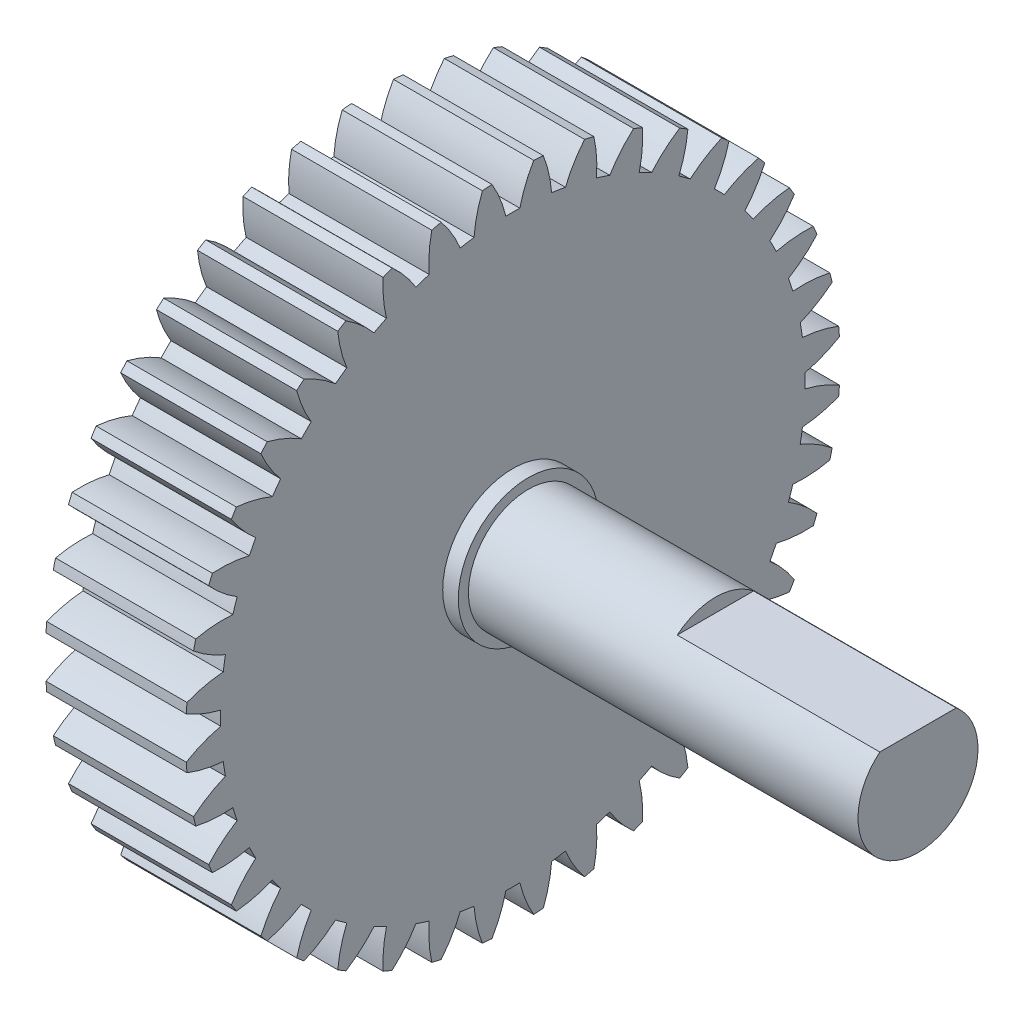
from build123d import *

# Parameters (mm, degrees)
BASPROSKE_W              = 9
BASPROSKE_H              = 21
TOOTHCUT_DEPTH           = 32.032241298
TEETHCUTS_COUNT          = 40
TEETHCUTS_ANGLE          = 351
BORSKE_R                 = 2
BORE_DEPTH               = 50.0000508
BOSS_EXTRUDE1_DEPTH      = 26
BOSS_EXTRUDE1_DEPTH_BACK = 9
BOSS_EXTRUDE2_DEPTH      = 13
BOSS_EXTRUDE2_DEPTH_BACK = 9
SKETCH1_4_R              = 4.5
BOSS_EXTRUDE3_DEPTH      = 1


with BuildPart() as part:
    # BasProSke → Base-Revolve (revolve)
    with BuildSketch(Plane(origin=(0, 0, 0), x_dir=(1, 0, 0), z_dir=(0, 1, 0))):
        with Locations((4.5, 10.5)):
            Rectangle(BASPROSKE_W, BASPROSKE_H)
    revolve(axis=Axis((-10, 0, 0), (1, 0, 0)))

    # TooCutSke → ToothCut (cut, through all)
    with BuildSketch(Plane(origin=(0, 0, 0), x_dir=(0, 0, -1), z_dir=(1, 0, 0))):
        with BuildLine():
            ThreePointArc((0.448673268, 18.74363074), (0, 18.749), (-0.448673268, 18.74363074))
            ThreePointArc((-0.448673268, 18.74363074), (-0.816786816, 19.89705013), (-1.354745081, 20.981708961))
            ThreePointArc((-1.354745081, 20.981708961), (0, 21.0254), (1.354745081, 20.981708961))
            ThreePointArc((1.354745081, 20.981708961), (0.816786816, 19.89705013), (0.448673268, 18.74363074))
        make_face()
    toothcut = extrude(amount=TOOTHCUT_DEPTH, mode=Mode.SUBTRACT)

    # TeethCuts: ToothCut ×40 about axis
    teethcuts_axis = Axis((-10, 0, 0), (1, 0, 0))
    for i in range(1, TEETHCUTS_COUNT):
        add(toothcut.rotate(teethcuts_axis, i * TEETHCUTS_ANGLE / (TEETHCUTS_COUNT - 1)), mode=Mode.SUBTRACT)

    # BorSke → Bore (cut, symmetric)
    with BuildSketch(Plane(origin=(0, 0, 0), x_dir=(0, 0, -1), z_dir=(1, 0, 0))):
        Circle(BORSKE_R)
    extrude(amount=BORE_DEPTH, both=True, mode=Mode.SUBTRACT)

    # Sketch1 → Boss-Extrude1 (add, two sides: drawn at the far end of the back side and taken through both)
    with BuildSketch(Plane(origin=(9, 0, 0), x_dir=(0, 0, -1), z_dir=(1, 0, 0)).offset(-BOSS_EXTRUDE1_DEPTH_BACK)):
        with BuildLine():
            Line((2.45, 2.969848481), (-2.45, 2.969848481))
            ThreePointArc((-2.45, 2.969848481), (-1.641645516, -3.48245603), (3.85, 0))
            ThreePointArc((3.85, 0), (3.48245603, 1.641645516), (2.45, 2.969848481))
        make_face()
    extrude(amount=BOSS_EXTRUDE1_DEPTH + BOSS_EXTRUDE1_DEPTH_BACK)

    # Sketch1<3> → Boss-Extrude2 (add, two sides: drawn at the far end of the back side and taken through both)
    with BuildSketch(Plane(origin=(9, 0, 0), x_dir=(0, 0, -1), z_dir=(1, 0, 0)).offset(-BOSS_EXTRUDE2_DEPTH_BACK)):
        with BuildLine():
            ThreePointArc((2.45, 2.969848481), (0, 3.85), (-2.45, 2.969848481))
            Line((-2.45, 2.969848481), (2.45, 2.969848481))
        make_face()
    extrude(amount=BOSS_EXTRUDE2_DEPTH + BOSS_EXTRUDE2_DEPTH_BACK)

    # Sketch1<4> → Boss-Extrude3 (add)
    with BuildSketch(Plane(origin=(9, 0, 0), x_dir=(0, 0, -1), z_dir=(1, 0, 0))):
        Circle(SKETCH1_4_R)
        with BuildLine():
            ThreePointArc((3.85, 0), (-1.641645516, -3.48245603), (-2.45, 2.969848481))
            ThreePointArc((-2.45, 2.969848481), (0, 3.85), (2.45, 2.969848481))
            ThreePointArc((2.45, 2.969848481), (3.48245603, 1.641645516), (3.85, 0))
        make_face(mode=Mode.SUBTRACT)
    extrude(amount=BOSS_EXTRUDE3_DEPTH)


solid = part.part
